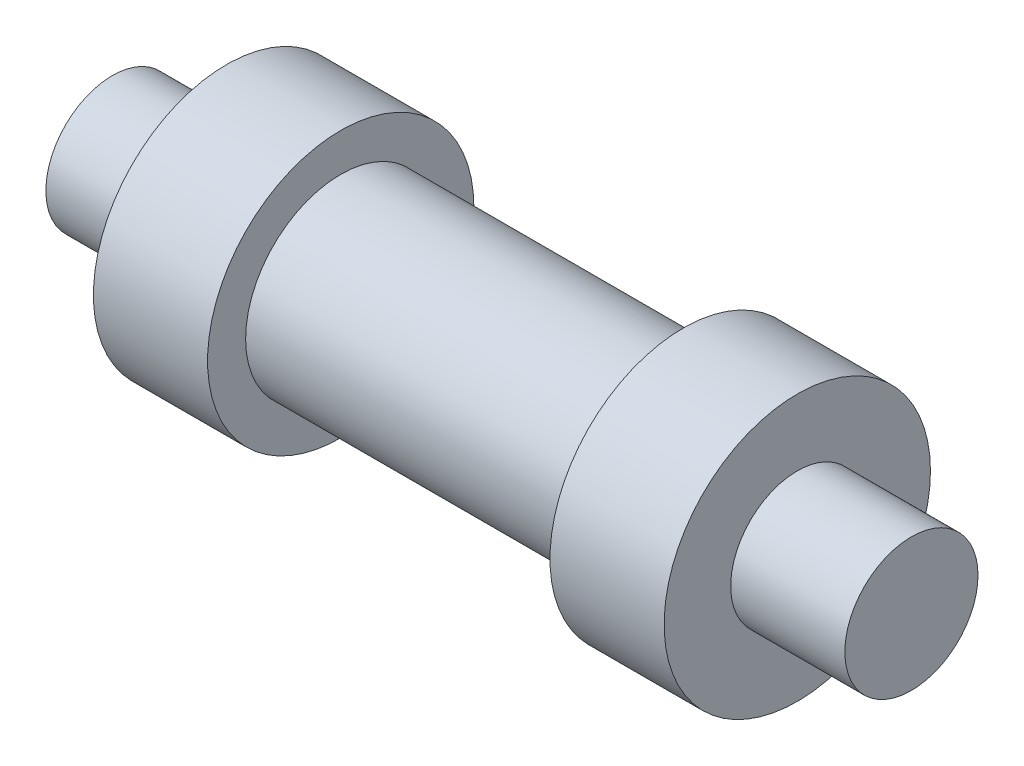
from build123d import *


with BuildPart() as part:
    # Sketch1 → Revolve1 (revolve)
    with BuildSketch(Plane.XY, mode=Mode.PRIVATE) as revolve1_sk:
        Polygon((21, 0), (-21, 0), (-21, 3.5), (-15, 3.5), (-15, 7), (-9, 7), (-9, 5), (9, 5), (9, 7), (15, 7), (15, 3.5), (21, 3.5), align=None)
    revolve(revolve1_sk.sketch.rotate(Axis((21, 0, 0), (-1, 0, 0)), 90), axis=Axis((21, 0, 0), (-1, 0, 0)))


solid = part.part
